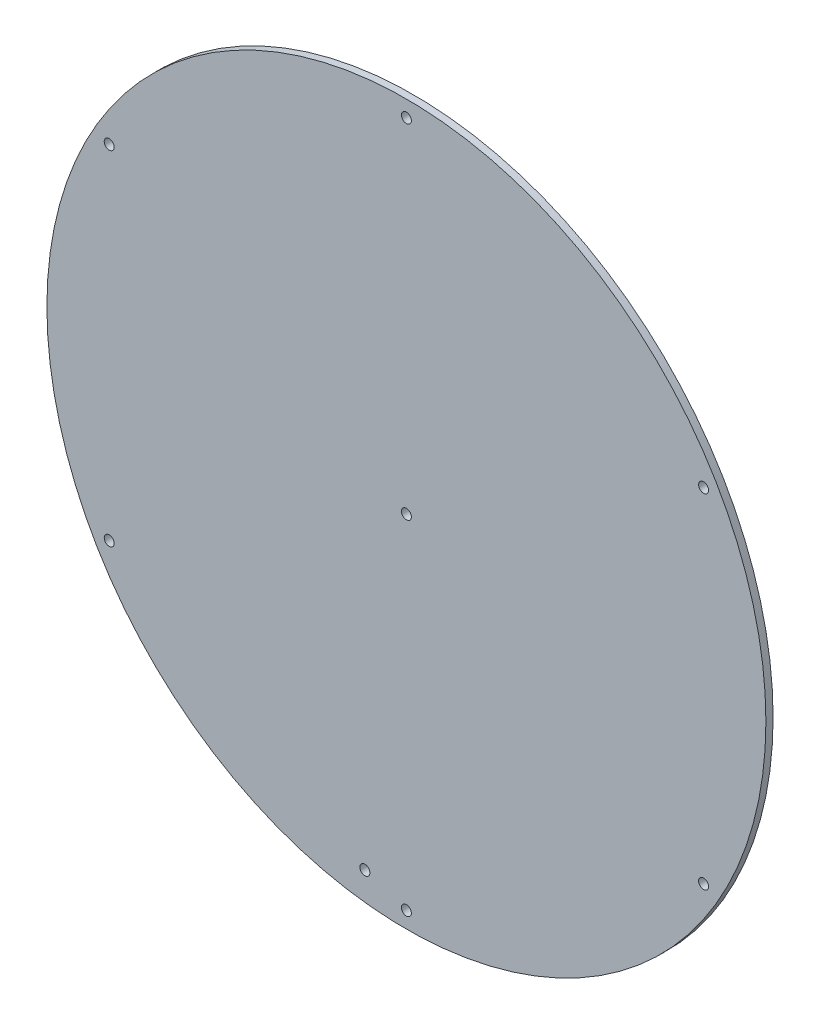
from build123d import *

# Parameters (mm, degrees)
SKETCH1_R            = 110
BOSS_EXTRUDE1_DEPTH  = 2.2
SKETCH2_R            = 1.524
CUT_EXTRUDE1_DEPTH   = 156.579047432
CIRPATTERN1_COUNT    = 6
SKETCH3_W            = 9
SKETCH3_H            = 9
CUT_EXTRUDE2_DEPTH   = 0.5
SKETCH12_RX          = 1.807909399
SKETCH12_RY          = 1
CUT_EXTRUDE5_DEPTH   = 0.2
LPATTERN1_COUNT      = 2
LPATTERN1_PITCH      = 3
LPATTERN1_COUNT_DIR2 = 2
LPATTERN1_PITCH_DIR2 = 6.096
SKETCH13_R           = 1.524
CUT_EXTRUDE6_DEPTH   = 156.579047432
SKETCH14_RX          = 1.75
SKETCH14_RY          = 0.9
CUT_EXTRUDE7_DEPTH   = 0.2
LPATTERN2_COUNT      = 2
LPATTERN2_PITCH      = 6.4
SKETCH15_RX          = 1.441806236
SKETCH15_RY          = 0.830559885
SKETCH15_W           = 1.559100293
SKETCH15_H           = 2.883612472
CUT_EXTRUDE8_DEPTH   = 0.2


with BuildPart() as part:
    # Sketch1 → Boss-Extrude1 (new body)
    with BuildSketch(Plane.XY):
        Circle(SKETCH1_R)
    extrude(amount=BOSS_EXTRUDE1_DEPTH)

    # Sketch2 → Cut-Extrude1 (cut, through all)
    with BuildSketch(Plane.XY.offset(2.2)):
        with Locations((0, 105)):
            Circle(SKETCH2_R)
    cut_extrude1 = extrude(amount=-CUT_EXTRUDE1_DEPTH, mode=Mode.SUBTRACT)

    # CirPattern1: Cut-Extrude1 ×6 about axis
    cirpattern1_axis = Axis((0, 0, 2.2), (0, 0, 1))
    for i in range(1, CIRPATTERN1_COUNT):
        add(cut_extrude1.rotate(cirpattern1_axis, i * 360 / CIRPATTERN1_COUNT), mode=Mode.SUBTRACT)

    # Sketch3 → Cut-Extrude2 (cut)
    with BuildSketch(Plane(origin=(0, 0, 0), x_dir=(-1, 0, 0), z_dir=(0, 0, -1))):
        with Locations((-10.67, 59.436)):
            Rectangle(SKETCH3_W, SKETCH3_H)
        with Locations((5.588, 59.436)):
            Rectangle(SKETCH3_W, SKETCH3_H)
    extrude(amount=-CUT_EXTRUDE2_DEPTH, mode=Mode.SUBTRACT)

    # Sketch12 → Cut-Extrude5 (cut)
    with BuildSketch(Plane(origin=(0, 0, 0), x_dir=(-1, 0, 0), z_dir=(0, 0, -1))):
        with Locations(Location((-1.6002, -10.668), (0, 0, 90))):
            Ellipse(SKETCH12_RX, SKETCH12_RY)
    cut_extrude5 = extrude(amount=-CUT_EXTRUDE5_DEPTH, mode=Mode.SUBTRACT)

    # LPattern1: Cut-Extrude5 2 × 2
    with Locations(*[(-i * LPATTERN1_PITCH, -j * LPATTERN1_PITCH_DIR2, 0) for i in range(LPATTERN1_COUNT) for j in range(LPATTERN1_COUNT_DIR2) if (i, j) != (0, 0)]):
        add(cut_extrude5, mode=Mode.SUBTRACT)

    # Sketch13 → Cut-Extrude6 (cut, through all)
    with BuildSketch(Plane(origin=(0, 0, 0), x_dir=(-1, 0, 0), z_dir=(0, 0, -1))):
        Circle(SKETCH13_R)
        with Locations((12.7, -100.6602)):
            Circle(SKETCH13_R)
    extrude(amount=-CUT_EXTRUDE6_DEPTH, mode=Mode.SUBTRACT)

    # Sketch14 → Cut-Extrude7 (cut)
    with BuildSketch(Plane(origin=(0, 0, 0), x_dir=(-1, 0, 0), z_dir=(0, 0, -1))):
        with Locations(Location((-3.2, -90.805), (0, 0, 180))):
            Ellipse(SKETCH14_RX, SKETCH14_RY)
    cut_extrude7 = extrude(amount=-CUT_EXTRUDE7_DEPTH, mode=Mode.SUBTRACT)

    # LPattern2: Cut-Extrude7 ×2
    with Locations(*[(-i * LPATTERN2_PITCH, 0, 0) for i in range(1, LPATTERN2_COUNT)]):
        add(cut_extrude7, mode=Mode.SUBTRACT)

    # Sketch15 → Cut-Extrude8 (cut)
    with BuildSketch(Plane(origin=(0, 0, 0), x_dir=(-1, 0, 0), z_dir=(0, 0, -1))):
        with Locations(Location((11.398915538, -96.592408929), (0, 0, 90))):
            Ellipse(SKETCH15_RX, SKETCH15_RY)
        with Locations((13.804777386, -96.592408929)):
            Rectangle(SKETCH15_W, SKETCH15_H)
    extrude(amount=-CUT_EXTRUDE8_DEPTH, mode=Mode.SUBTRACT)


solid = part.part
